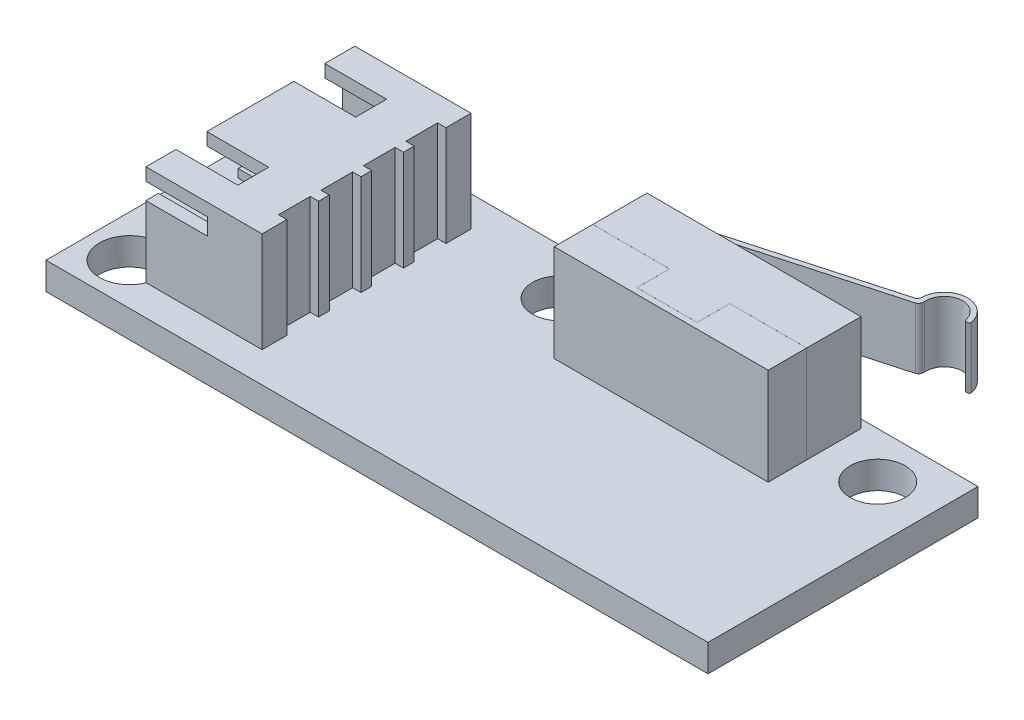
from build123d import *

# Parameters (mm, degrees)
SKETCH1_W           = 39.6
SKETCH1_H           = 16.15
SKETCH1_R           = 1.8
SKETCH1_R_2         = 1.65
BOSS_EXTRUDE1_DEPTH = 1.63
SKETCH2_W           = 6.95
SKETCH2_H           = 12.5
BOSS_EXTRUDE2_DEPTH = 6
SKETCH3_W           = 11
SKETCH3_H           = 4.5
CUT_EXTRUDE1_DEPTH  = 4.65
SKETCH4_W           = 1.85
SKETCH4_H           = 0.75
SKETCH4_W_2         = 0.75
SKETCH4_H_2         = 1
CUT_EXTRUDE2_DEPTH  = 3.7
SKETCH5_W           = 0.5
SKETCH5_H           = 1.9
CUT_EXTRUDE3_DEPTH  = 6
SKETCH6_W           = 0.6
SKETCH6_H           = 0.5
BOSS_EXTRUDE3_DEPTH = 3.9
CHAMFER1_SIZE       = 0.1
BOSS_EXTRUDE4_DEPTH = 5.8
BOSS_EXTRUDE5_DEPTH = 5.8
SKETCH9_W           = 1
SKETCH9_H           = 2.8
BOSS_EXTRUDE6_DEPTH = 0.75
FILLET1_R           = 0.25
BOSS_EXTRUDE7_DEPTH = 3.65
CUT_EXTRUDE4_DEPTH  = 0.3


with BuildPart() as part:
    # Sketch1 → Boss-Extrude1 (new body)
    with BuildSketch(Plane(origin=(0, 0, 0), x_dir=(1, 0, 0), z_dir=(0, 1, 0))):
        Rectangle(SKETCH1_W, SKETCH1_H)
        with Locations(Location((-17.3, 5.575, 0), (0, 0, 270))):
            Circle(SKETCH1_R, mode=Mode.SUBTRACT)
        with Locations(Location((-17.3, -5.575, 0), (0, 0, 270))):
            Circle(SKETCH1_R, mode=Mode.SUBTRACT)
        with Locations(Location((-2.45, 5.325, 0), (0, 0, 270))):
            Circle(SKETCH1_R_2, mode=Mode.SUBTRACT)
        with Locations(Location((16.55, 5.325, 0), (0, 0, 270))):
            Circle(SKETCH1_R_2, mode=Mode.SUBTRACT)
    extrude(amount=BOSS_EXTRUDE1_DEPTH)

    # Sketch2 → Boss-Extrude2 (add)
    with BuildSketch(Plane(origin=(0, 1.63, 0), x_dir=(1, 0, 0), z_dir=(0, 1, 0))):
        with Locations((-12.175, 0)):
            Rectangle(SKETCH2_W, SKETCH2_H)
    extrude(amount=BOSS_EXTRUDE2_DEPTH)

    # Sketch3 → Cut-Extrude1 (cut)
    with BuildSketch(Plane.ZY.offset(15.65)):
        with Locations((0, 4.63)):
            Rectangle(SKETCH3_W, SKETCH3_H)
    extrude(amount=-CUT_EXTRUDE1_DEPTH, mode=Mode.SUBTRACT)

    # Sketch4 → Cut-Extrude2 (cut)
    with BuildSketch(Plane.ZY.offset(15.65)):
        with Locations((-3.525, 7.255)):
            Rectangle(SKETCH4_W, SKETCH4_H)
        with Locations((-5.875, 6.38)):
            Rectangle(SKETCH4_W_2, SKETCH4_H_2)
        with Locations((5.875, 6.38)):
            Rectangle(SKETCH4_W_2, SKETCH4_H_2)
        with Locations((3.525, 7.255)):
            Rectangle(SKETCH4_W, SKETCH4_H)
    extrude(amount=-CUT_EXTRUDE2_DEPTH, mode=Mode.SUBTRACT)

    # Sketch5 → Cut-Extrude3 (cut)
    with BuildSketch(Plane(origin=(0, 7.63, 0), x_dir=(1, 0, 0), z_dir=(0, 1, 0))):
        with Locations((-8.95, 3.8)):
            Rectangle(SKETCH5_W, SKETCH5_H)
        with Locations((-8.95, 1.26)):
            Rectangle(SKETCH5_W, SKETCH5_H)
        with Locations((-8.95, -1.28)):
            Rectangle(SKETCH5_W, SKETCH5_H)
        with Locations((-8.95, -3.82)):
            Rectangle(SKETCH5_W, SKETCH5_H)
    extrude(amount=-CUT_EXTRUDE3_DEPTH, mode=Mode.SUBTRACT)

    # Sketch6 → Boss-Extrude3 (add)
    with BuildSketch(Plane.ZY.offset(11)):
        with Locations((-3.8, 5.38)):
            Rectangle(SKETCH6_W, SKETCH6_H)
        with Locations((-1.26, 5.38)):
            Rectangle(SKETCH6_W, SKETCH6_H)
        with Locations((1.28, 5.38)):
            Rectangle(SKETCH6_W, SKETCH6_H)
        with Locations((3.82, 5.38)):
            Rectangle(SKETCH6_W, SKETCH6_H)
    extrude(amount=BOSS_EXTRUDE3_DEPTH)

    # Chamfer1
    chamfer1_edges = [part.edges().sort_by_distance(p)[0] for p in [
        (-14.9, 5.38, -4.1),
        (-14.9, 5.13, -3.8),
        (-14.9, 5.38, -3.5),
        (-14.9, 5.63, -3.8),
        (-14.9, 5.63, -1.26),
        (-14.9, 5.38, -1.56),
        (-14.9, 5.13, -1.26),
        (-14.9, 5.38, -0.96),
        (-14.9, 5.63, 1.28),
        (-14.9, 5.38, 0.98),
        (-14.9, 5.13, 1.28),
        (-14.9, 5.38, 1.58),
        (-14.9, 5.63, 3.82),
        (-14.9, 5.38, 3.52),
        (-14.9, 5.13, 3.82),
        (-14.9, 5.38, 4.12),
    ]]
    chamfer(chamfer1_edges, length=CHAMFER1_SIZE)

    # Sketch7 → Boss-Extrude4 (add)
    with BuildSketch(Plane(origin=(0, 1.63, 0), x_dir=(1, 0, 0), z_dir=(0, 1, 0))):
        Polygon((0.5, 7.575), (13.3, 7.575), (13.3, 4.325), (8.7, 4.325), (8.7, 2.375), (5.1, 2.375), (5.1, 4.325), (0.5, 4.325), align=None)
    extrude(amount=BOSS_EXTRUDE4_DEPTH)

    # Sketch8 → Boss-Extrude5 (add)
    with BuildSketch(Plane(origin=(0, 1.63, 0), x_dir=(1, 0, 0), z_dir=(0, 1, 0))):
        Polygon((0.5, 4.324), (0.5, 2.025), (13.3, 2.025), (13.3, 4.324), (8.701, 4.324), (8.701, 2.374), (5.099, 2.374), (5.099, 4.324), align=None)
    extrude(amount=BOSS_EXTRUDE5_DEPTH)

    # Sketch9 → Boss-Extrude6 (add)
    with BuildSketch(Plane(origin=(0, 0, -7.575), x_dir=(-1, 0, 0), z_dir=(0, 0, -1))):
        with Locations((-4.8, 4.53)):
            Rectangle(SKETCH9_W, SKETCH9_H)
    extrude(amount=BOSS_EXTRUDE6_DEPTH)

    # Fillet1
    fillet1_edges = [part.edges().sort_by_distance(p)[0] for p in [
        (4.3, 4.53, -8.325),
        (5.3, 4.53, -8.325),
    ]]
    fillet(fillet1_edges, radius=FILLET1_R)

    # Sketch10 → Boss-Extrude7 (add)
    with BuildSketch(Plane(origin=(0, 2.88, 0), x_dir=(1, 0, 0), z_dir=(0, 1, 0))):
        with BuildLine():
            ThreePointArc((1.986591762, 7.65728792), (1.960185355, 7.63936483), (1.95, 7.609119267))
            Line((1.95, 7.609119267), (1.95, 7.575))
            Line((1.95, 7.575), (1.65, 7.575))
            Line((1.65, 7.575), (1.65, 7.685085191))
            ThreePointArc((1.65, 7.685085191), (1.700926776, 7.836313004), (1.832958812, 7.925928458))
            Line((1.832958812, 7.925928458), (13.03488517, 11.044099284))
            ThreePointArc((13.03488517, 11.044099284), (13.164742187, 11.130893542), (13.217742469, 11.277818891))
            ThreePointArc((13.217742469, 11.277818891), (14.51265049, 12.6340191), (15.995064384, 11.485753085))
            ThreePointArc((15.995064384, 11.485753085), (15.976497018, 11.407856176), (15.906722272, 11.368560369))
            Line((15.906722272, 11.368560369), (15.806911036, 11.35844928))
            ThreePointArc((15.806911036, 11.35844928), (15.736894481, 11.377893571), (15.698527539, 11.439605615))
            ThreePointArc((15.698527539, 11.439605615), (14.474302897, 12.328608683), (13.520358774, 11.154282051))
            Line((13.520358774, 11.154282051), (13.502671925, 11.020626045))
            ThreePointArc((13.502671925, 11.020626045), (13.443534072, 10.889435933), (13.321873718, 10.812579642))
            Line((13.321873718, 10.812579642), (1.986591762, 7.65728792))
        make_face()
    extrude(amount=BOSS_EXTRUDE7_DEPTH)

    # Sketch11 → Cut-Extrude4 (cut)
    with BuildSketch(Plane(origin=(1.123559568, 0, -7.728459919), x_dir=(0.9633730670576666, 0, -0.26816475097951425), z_dir=(0.26816475097951425, 0, 0.9633730670576666))):
        with BuildLine():
            Line((0.466005992, 5.13), (8.136005992, 5.13))
            ThreePointArc((8.136005992, 5.13), (8.561005992, 4.705), (8.136005992, 4.28))
            Line((8.136005992, 4.28), (0.466005992, 4.28))
            Line((0.466005992, 4.28), (0.466005992, 5.13))
        make_face()
    extrude(amount=CUT_EXTRUDE4_DEPTH, mode=Mode.SUBTRACT)


solid = part.part
